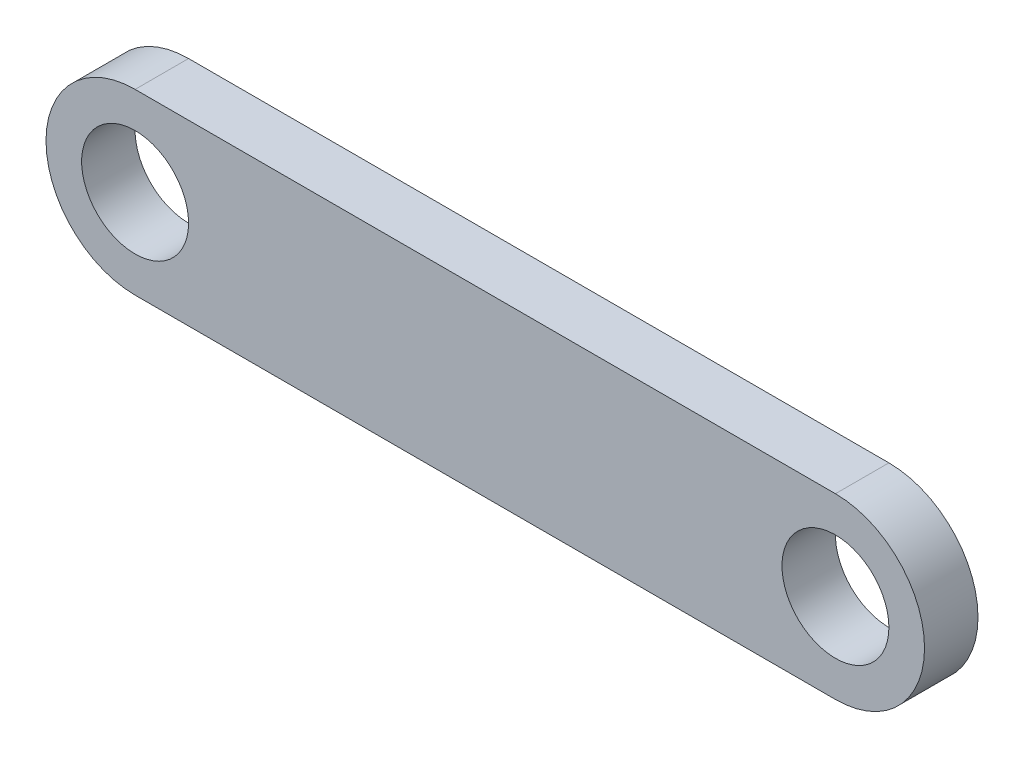
from build123d import *

# Parameters (mm, degrees)
SKETCH_1_R      = 3
EXTRUDE_1_DEPTH = 3


with BuildPart() as part:
    # ｽｹｯﾁ1 → ﾎﾞｽ - 押し出し1 (new body)
    with BuildSketch(Plane.XY):
        with BuildLine():
            Line((-19.65, 5), (19.65, 5))
            ThreePointArc((19.65, 5), (24.65, 0), (19.65, -5))
            Line((19.65, -5), (-19.65, -5))
            ThreePointArc((-19.65, -5), (-24.65, 0), (-19.65, 5))
        make_face()
        with Locations((-19.65, 0)):
            Circle(SKETCH_1_R, mode=Mode.SUBTRACT)
        with Locations((19.65, 0)):
            Circle(SKETCH_1_R, mode=Mode.SUBTRACT)
    extrude(amount=EXTRUDE_1_DEPTH)


solid = part.part
